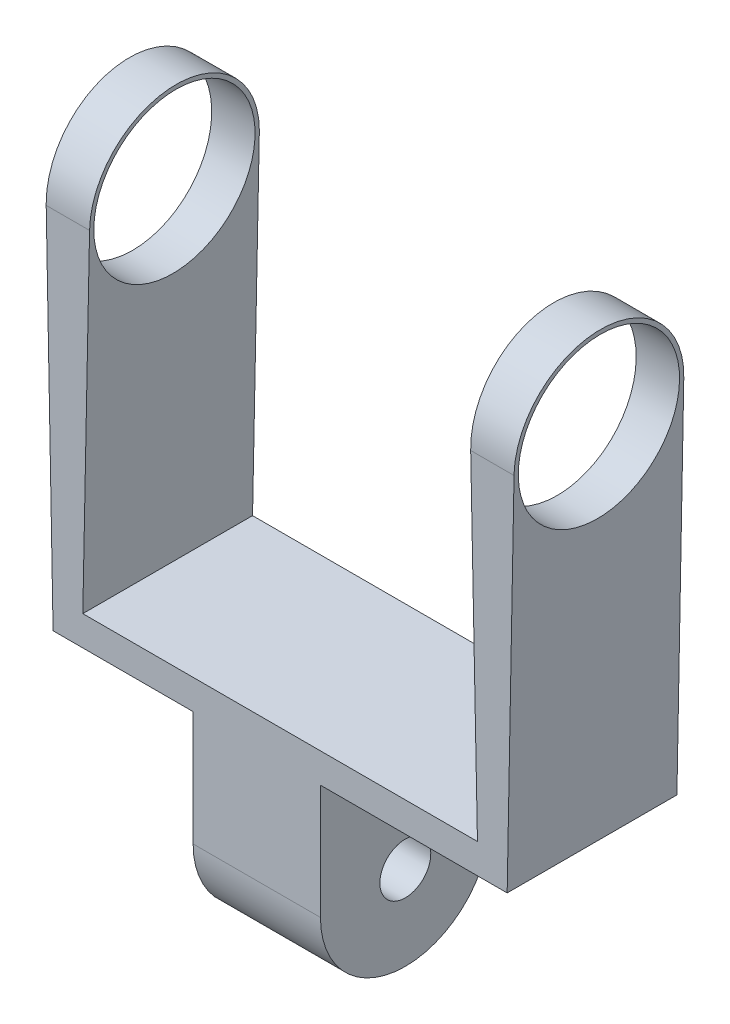
from build123d import *

# Parameters (mm, degrees)
BOSS_EXTRU_1_DEPTH           = 40
ENL_V_MAT_EXTRU_1_DEPTH      = 158.898579133
ENL_V_MAT_EXTRU_1_DEPTH_BACK = 158.898579133
ESQUISSE2_R                  = 19
ESQUISSE3_W                  = 30
ESQUISSE3_H                  = 40
BOSS_EXTRU_2_DEPTH           = 47
ENL_V_MAT_EXTRU_2_DEPTH      = 137.425804011
ESQUISSE6_R                  = 6
ENL_V_MAT_EXTRU_3_DEPTH      = 137.425804011


with BuildPart() as part:
    # Esquisse1 → Boss.-Extru.1 (new body)
    with BuildSketch(Plane.XY):
        Polygon((7, 7), (100, 7), (98, 106), (109, 106), (107, 0), (0, 0), (-2, 106), (9, 106), align=None)
    extrude(amount=BOSS_EXTRU_1_DEPTH)

    # Esquisse2 → Enlèv. mat.-Extru.1 (cut, two sides: drawn at the far end of the back side and taken through both)
    with BuildSketch(Plane(origin=(0, -1.009164524, 0), x_dir=(0, 0, -1), z_dir=(1, 0, 0)).offset(-ENL_V_MAT_EXTRU_1_DEPTH_BACK)):
        with Locations(Location((-20, 87.009164524, 0), (0, 0, 90))):
            Circle(ESQUISSE2_R)
        with BuildLine():
            Line((-40, 107.009164524), (-40, 87.009164524))
            ThreePointArc((-40, 87.009164524), (-34.142135624, 101.151300148), (-20, 107.009164524))
            Line((-20, 107.009164524), (-40, 107.009164524))
        make_face()
        with BuildLine():
            ThreePointArc((-20, 107.009164524), (-5.857864376, 101.151300148), (0, 87.009164524))
            Line((0, 87.009164524), (0, 107.009164524))
            Line((0, 107.009164524), (-20, 107.009164524))
        make_face()
    extrude(amount=ENL_V_MAT_EXTRU_1_DEPTH + ENL_V_MAT_EXTRU_1_DEPTH_BACK, mode=Mode.SUBTRACT)

    # Esquisse3 → Boss.-Extru.2 (add)
    with BuildSketch(Plane.XZ):
        with Locations((48, 20)):
            Rectangle(ESQUISSE3_W, ESQUISSE3_H)
    extrude(amount=BOSS_EXTRU_2_DEPTH)

    # Esquisse5 → Enlèv. mat.-Extru.2 (cut, through all)
    with BuildSketch(Plane.ZY.offset(-33)):
        with BuildLine():
            Line((20, -47), (40, -47))
            Line((40, -47), (40, -27))
            ThreePointArc((40, -27), (34.142135624, -41.142135624), (20, -47))
        make_face()
        with BuildLine():
            Line((0, -47), (20, -47))
            ThreePointArc((20, -47), (5.857864376, -41.142135624), (0, -27))
            Line((0, -27), (0, -47))
        make_face()
    extrude(amount=-ENL_V_MAT_EXTRU_2_DEPTH, mode=Mode.SUBTRACT)

    # Esquisse6 → Enlèv. mat.-Extru.3 (cut, through all)
    with BuildSketch(Plane.ZY.offset(-33)):
        with Locations(Location((20, -27, 0), (0, 0, 270))):
            Circle(ESQUISSE6_R)
    extrude(amount=-ENL_V_MAT_EXTRU_3_DEPTH, mode=Mode.SUBTRACT)


solid = part.part
